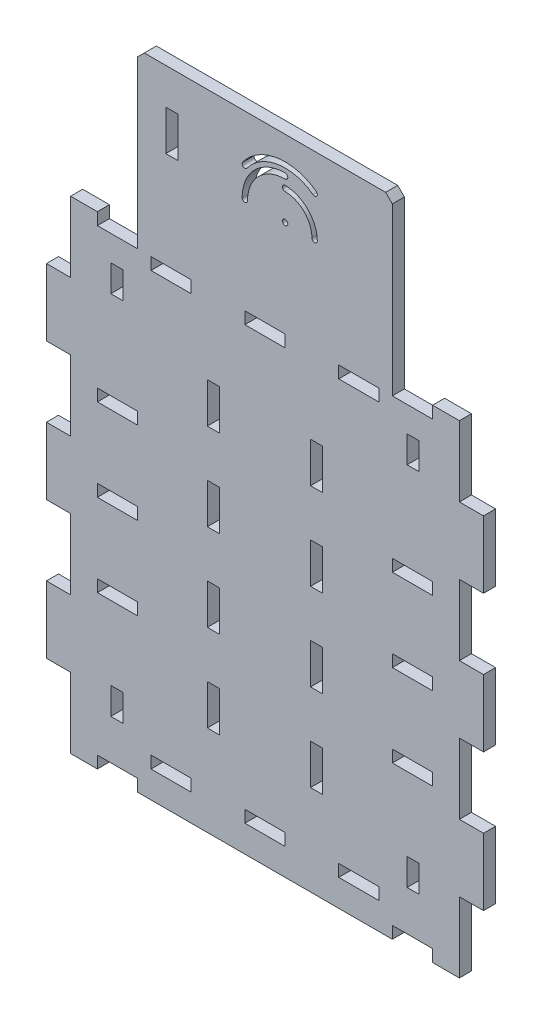
from build123d import *

# Parameters (mm, degrees)
MODEL_R             = 2
MODEL_W             = 9
MODEL_H             = 30
MODEL_W_2           = 30
MODEL_H_2           = 9
MODEL_H_3           = 20
BOSS_EXTRUDE1_DEPTH = 9


with BuildPart() as part:
    # Model → Boss-Extrude1 (new body)
    with BuildSketch(Plane.XY):
        Polygon((-90, 480), (-95, 475), (-95, 351), (-125, 351), (-125, 360), (-145, 360), (-145, 307.5), (-163, 307.5), (-163, 257.5), (-145, 257.5), (-145, 205), (-163, 205), (-163, 155), (-145, 155), (-145, 102.5), (-163, 102.5), (-163, 52.5), (-145, 52.5), (-145, 0), (-125, 0), (-125, 9), (-95, 9), (-95, 0), (95, 0), (95, 9), (125, 9), (125, 0), (145, 0), (145, 52.5), (163, 52.5), (163, 102.5), (145, 102.5), (145, 155), (163, 155), (163, 205), (145, 205), (145, 257.5), (163, 257.5), (163, 307.5), (145, 307.5), (145, 360), (125, 360), (125, 351), (95, 351), (95, 475), (90, 480), align=None)
        with Locations((15.03, 423)):
            Circle(MODEL_R, mode=Mode.SUBTRACT)
        with Locations((-69.47, 438.03)):
            Rectangle(MODEL_W, MODEL_H, mode=Mode.SUBTRACT)
        with Locations((-110, 180)):
            Rectangle(MODEL_W_2, MODEL_H_2, mode=Mode.SUBTRACT)
        with Locations((-110, 241.6)):
            Rectangle(MODEL_W_2, MODEL_H_2, mode=Mode.SUBTRACT)
        with Locations((-110, 118.4)):
            Rectangle(MODEL_W_2, MODEL_H_2, mode=Mode.SUBTRACT)
        with Locations((-38.5, 212.5)):
            Rectangle(MODEL_W, MODEL_H, mode=Mode.SUBTRACT)
        with Locations((-38.5, 277.5)):
            Rectangle(MODEL_W, MODEL_H, mode=Mode.SUBTRACT)
        with Locations((-38.5, 147.5)):
            Rectangle(MODEL_W, MODEL_H, mode=Mode.SUBTRACT)
        with Locations((-38.5, 82.5)):
            Rectangle(MODEL_W, MODEL_H, mode=Mode.SUBTRACT)
        with Locations((-70, 346.5)):
            Rectangle(MODEL_W_2, MODEL_H_2, mode=Mode.SUBTRACT)
        with Locations((0, 24.5)):
            Rectangle(MODEL_W_2, MODEL_H_2, mode=Mode.SUBTRACT)
        with Locations((-110.5, 322)):
            Rectangle(MODEL_W, MODEL_H_3, mode=Mode.SUBTRACT)
        with Locations((-70, 24.5)):
            Rectangle(MODEL_W_2, MODEL_H_2, mode=Mode.SUBTRACT)
        with Locations((-110.5, 49)):
            Rectangle(MODEL_W, MODEL_H_3, mode=Mode.SUBTRACT)
        with Locations((0, 346.5)):
            Rectangle(MODEL_W_2, MODEL_H_2, mode=Mode.SUBTRACT)
        with Locations((70, 346.5)):
            Rectangle(MODEL_W_2, MODEL_H_2, mode=Mode.SUBTRACT)
        with Locations((110, 118.4)):
            Rectangle(MODEL_W_2, MODEL_H_2, mode=Mode.SUBTRACT)
        with Locations((110, 180)):
            Rectangle(MODEL_W_2, MODEL_H_2, mode=Mode.SUBTRACT)
        with Locations((110, 241.6)):
            Rectangle(MODEL_W_2, MODEL_H_2, mode=Mode.SUBTRACT)
        with Locations((110.5, 322)):
            Rectangle(MODEL_W, MODEL_H_3, mode=Mode.SUBTRACT)
        with Locations((38.5, 277.5)):
            Rectangle(MODEL_W, MODEL_H, mode=Mode.SUBTRACT)
        with Locations((38.5, 212.5)):
            Rectangle(MODEL_W, MODEL_H, mode=Mode.SUBTRACT)
        with Locations((38.5, 147.5)):
            Rectangle(MODEL_W, MODEL_H, mode=Mode.SUBTRACT)
        with Locations((38.5, 82.5)):
            Rectangle(MODEL_W, MODEL_H, mode=Mode.SUBTRACT)
        with Locations((110.5, 49)):
            Rectangle(MODEL_W, MODEL_H_3, mode=Mode.SUBTRACT)
        with Locations((70, 24.5)):
            Rectangle(MODEL_W_2, MODEL_H_2, mode=Mode.SUBTRACT)
        with BuildLine():
            ThreePointArc((39.03, 423), (32.000562748, 439.970562748), (15.03, 447))
            ThreePointArc((15.03, 447), (13.03, 445), (15.03, 443))
            ThreePointArc((15.03, 443), (29.172135624, 437.142135624), (35.03, 423))
            ThreePointArc((35.03, 423), (37.03, 421), (39.03, 423))
        make_face(mode=Mode.SUBTRACT)
        with BuildLine():
            ThreePointArc((38.21119056, 454.673935829), (9.024722229, 461.788431853), (-16.643935829, 446.18119056))
            ThreePointArc((-16.643935829, 446.18119056), (-16.21119056, 443.386064171), (-13.416064171, 443.81880944))
            ThreePointArc((-13.416064171, 443.81880944), (9.636716458, 457.835526204), (35.84880944, 451.446064171))
            ThreePointArc((35.84880944, 451.446064171), (38.643935829, 451.87880944), (38.21119056, 454.673935829))
        make_face(mode=Mode.SUBTRACT)
        with BuildLine():
            ThreePointArc((15.03, 455.06), (-7.639843405, 445.669843405), (-17.03, 423))
            ThreePointArc((-17.03, 423), (-15.03, 421), (-13.03, 423))
            ThreePointArc((-13.03, 423), (-4.81141628, 442.84141628), (15.03, 451.06))
            ThreePointArc((15.03, 451.06), (17.03, 453.06), (15.03, 455.06))
        make_face(mode=Mode.SUBTRACT)
    extrude(amount=BOSS_EXTRUDE1_DEPTH)


solid = part.part
